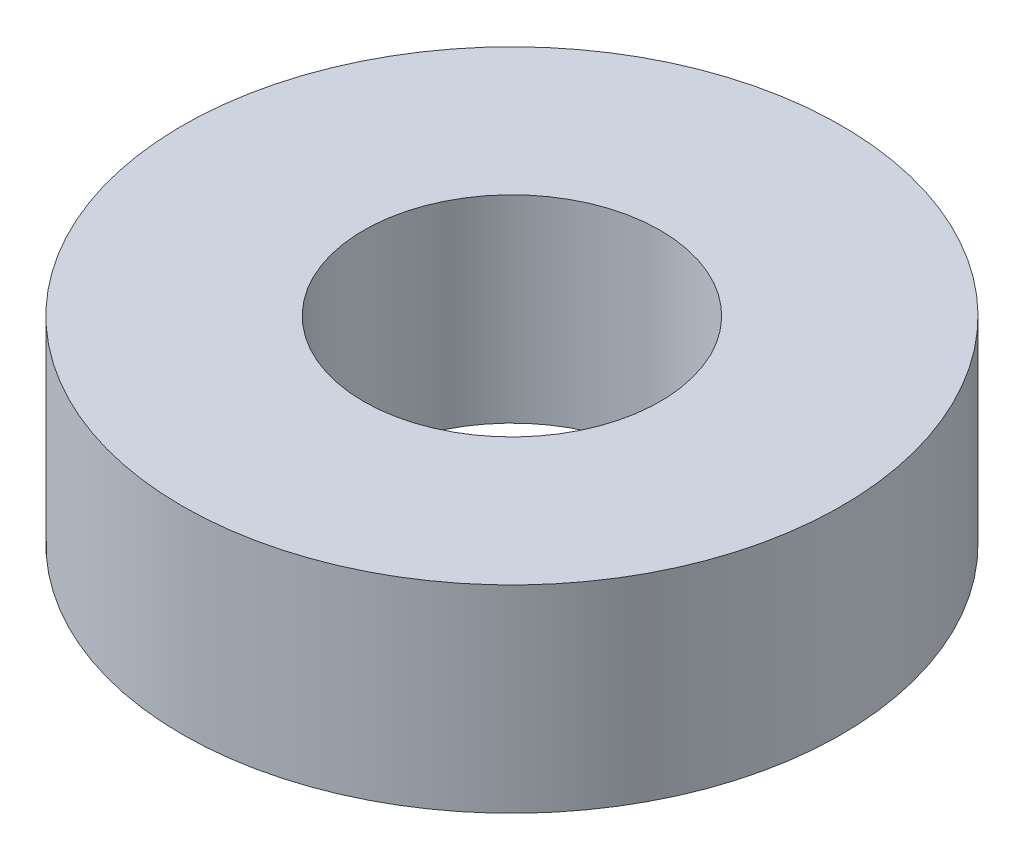
from build123d import *

# Parameters (mm, degrees)
CROQUIS1_R              = 10
CROQUIS1_R_2            = 4.5
SALIENTE_EXTRUIR1_DEPTH = 6


with BuildPart() as part:
    # Croquis1 → Saliente-Extruir1 (new body)
    with BuildSketch(Plane(origin=(0, 0, 0), x_dir=(1, 0, 0), z_dir=(0, 1, 0))):
        with Locations(Location((0, 0, 0), (0, 0, 270))):
            Circle(CROQUIS1_R)
        with Locations(Location((0, 0, 0), (0, 0, 270))):
            Circle(CROQUIS1_R_2, mode=Mode.SUBTRACT)
    extrude(amount=SALIENTE_EXTRUIR1_DEPTH)


solid = part.part
